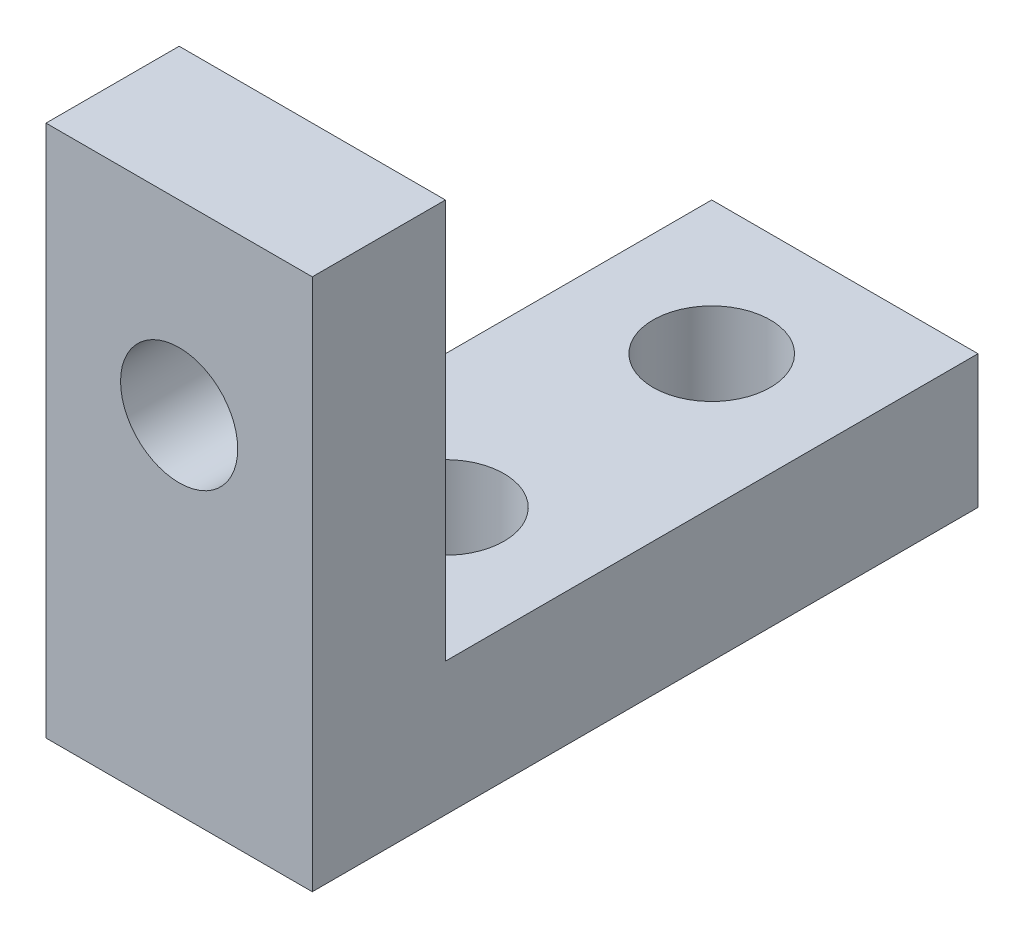
from build123d import *

# Parameters (mm, degrees)
SKETCH1_W           = 5
SKETCH1_H           = 15
SKETCH1_H_2         = 5
SKETCH1_W_2         = 20
BOSS_EXTRUDE1_DEPTH = 10
SKETCH2_R           = 2.2
CUT_EXTRUDE1_DEPTH  = 10
SKETCH3_R           = 2.2
CUT_EXTRUDE2_DEPTH  = 10


with BuildPart() as part:
    # Sketch1 → Boss-Extrude1 (new body)
    with BuildSketch(Plane(origin=(0, 0, 0), x_dir=(0, 0, -1), z_dir=(1, 0, 0))):
        with Locations((2.5, 12.5)):
            Rectangle(SKETCH1_W, SKETCH1_H)
        with Locations((2.5, 2.5)):
            Rectangle(SKETCH1_W, SKETCH1_H_2)
        with Locations((15, 2.5)):
            Rectangle(SKETCH1_W_2, SKETCH1_H_2)
    extrude(amount=BOSS_EXTRUDE1_DEPTH)

    # Sketch2 → Cut-Extrude1 (cut)
    with BuildSketch(Plane(origin=(0, 0, -5), x_dir=(-1, 0, 0), z_dir=(0, 0, -1))):
        with Locations((-5, 13)):
            Circle(SKETCH2_R)
    extrude(amount=-CUT_EXTRUDE1_DEPTH, mode=Mode.SUBTRACT)

    # Sketch3 → Cut-Extrude2 (cut)
    with BuildSketch(Plane(origin=(0, 5, 0), x_dir=(1, 0, 0), z_dir=(0, 1, 0))):
        with Locations(Location((5, 20, 0), (0, 0, 270))):
            Circle(SKETCH3_R)
        with Locations(Location((5, 10, 0), (0, 0, 270))):
            Circle(SKETCH3_R)
    extrude(amount=-CUT_EXTRUDE2_DEPTH, mode=Mode.SUBTRACT)


solid = part.part
